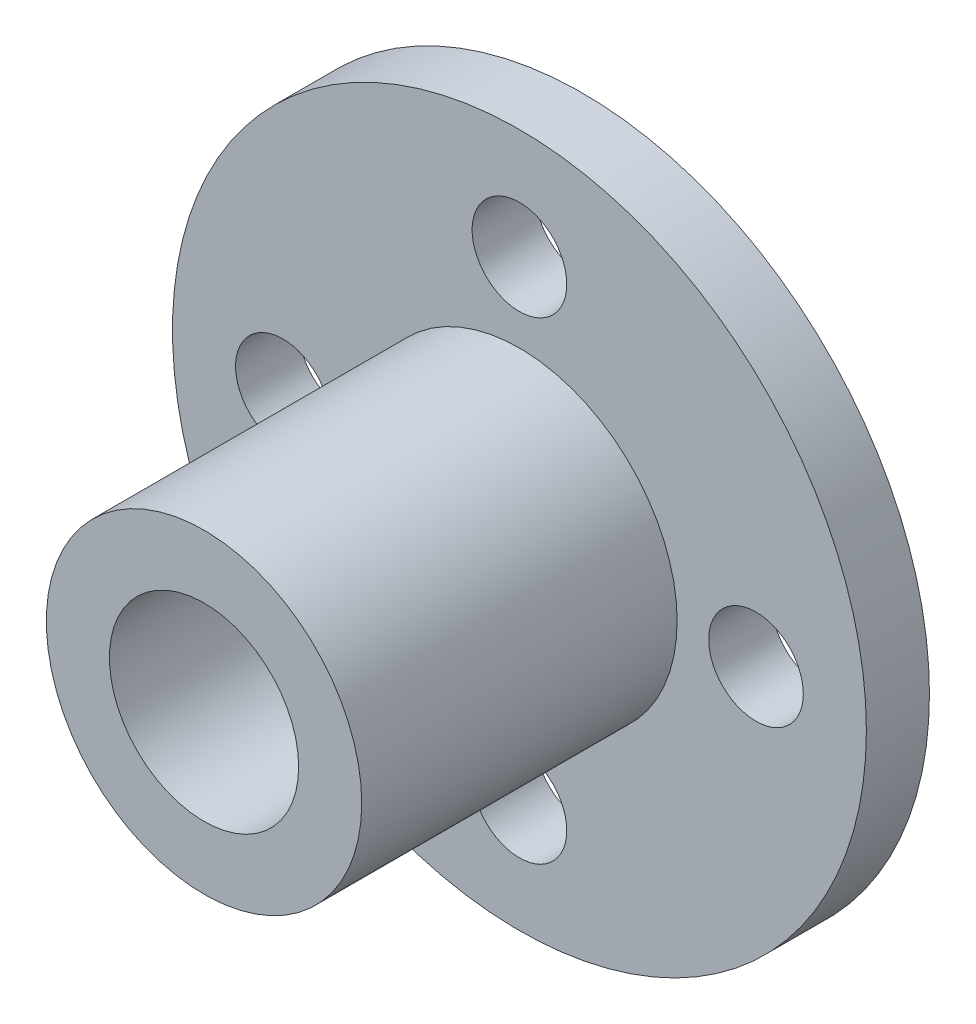
from build123d import *

# Parameters (mm, degrees)
SKETCH1_R           = 11
BOSS_EXTRUDE1_DEPTH = 2
SKETCH2_R           = 5
BOSS_EXTRUDE2_DEPTH = 10
SKETCH3_R           = 3
CUT_EXTRUDE1_DEPTH  = 20
SKETCH4_R           = 1.5
CUT_EXTRUDE2_DEPTH  = 20


with BuildPart() as part:
    # Sketch1 → Boss-Extrude1 (new body)
    with BuildSketch(Plane.XY):
        Circle(SKETCH1_R)
    extrude(amount=BOSS_EXTRUDE1_DEPTH)

    # Sketch2 → Boss-Extrude2 (add)
    with BuildSketch(Plane.XY.offset(2)):
        Circle(SKETCH2_R)
    extrude(amount=BOSS_EXTRUDE2_DEPTH)

    # Sketch3 → Cut-Extrude1 (cut)
    with BuildSketch(Plane.XY.offset(12)):
        Circle(SKETCH3_R)
    extrude(amount=-CUT_EXTRUDE1_DEPTH, mode=Mode.SUBTRACT)

    # Sketch4 → Cut-Extrude2 (cut)
    with BuildSketch(Plane.XY.offset(2)):
        with Locations((0, 7.5)):
            Circle(SKETCH4_R)
        with Locations((7.5, 0)):
            Circle(SKETCH4_R)
        with Locations((0, -7.5)):
            Circle(SKETCH4_R)
        with Locations((-7.5, 0)):
            Circle(SKETCH4_R)
    extrude(amount=-CUT_EXTRUDE2_DEPTH, mode=Mode.SUBTRACT)


solid = part.part
